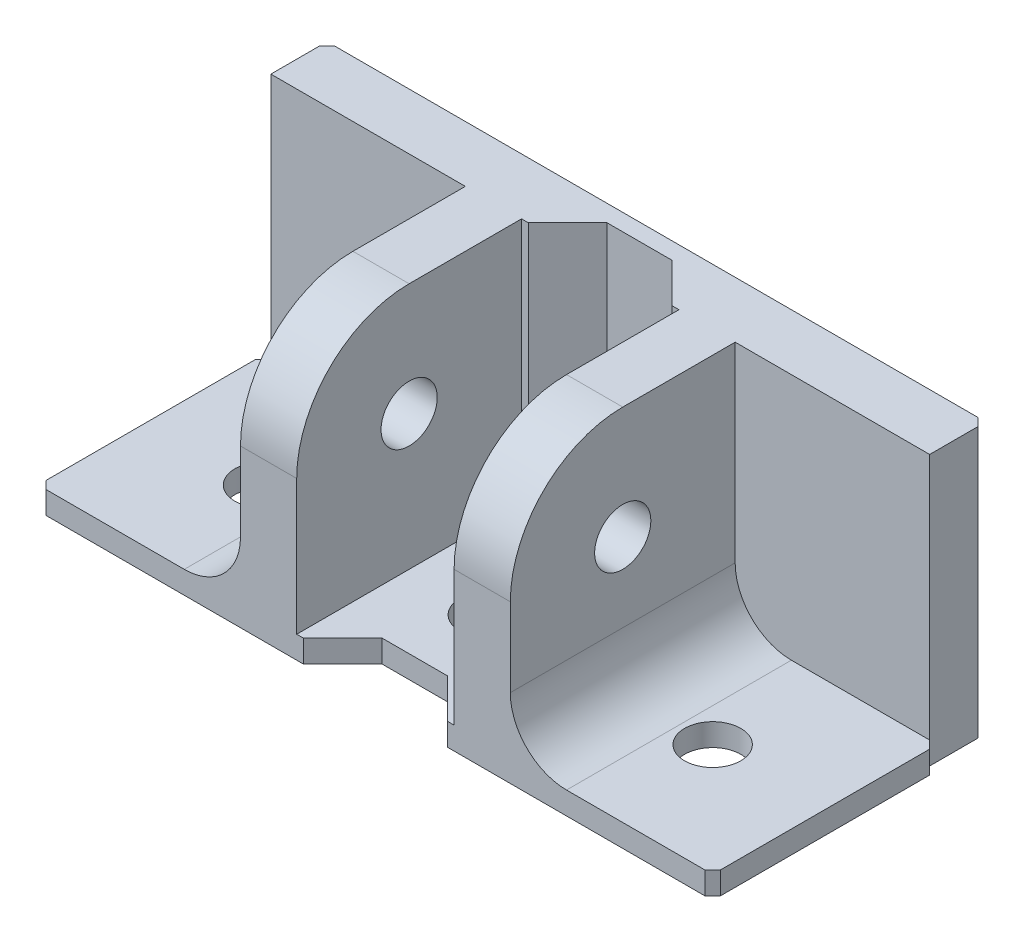
from build123d import *

# Parameters (mm, degrees)
SKETCH1_W           = 60
SKETCH1_H           = 20
SKETCH1_R           = 2.5
BOSS_EXTRUDE1_DEPTH = 2
FILLET1_SIZE        = 0.7
CUT_EXTRUDE2_DEPTH  = 2
BOSS_EXTRUDE3_DEPTH = 22
BOSS_EXTRUDE4_DEPTH = 24
CUT_EXTRUDE3_DEPTH  = 24
SKETCH6_R           = 2.5
CUT_EXTRUDE4_DEPTH  = 55.45181356
FILLET2_R           = 10
FILLET4_R           = 5
CHAMFER1_SIZE       = 0.7


with BuildPart() as part:
    # Sketch1 → Boss-Extrude1 (new body)
    with BuildSketch(Plane(origin=(0, 0, 0), x_dir=(1, 0, 0), z_dir=(0, 1, 0))):
        with Locations((30, 10)):
            Rectangle(SKETCH1_W, SKETCH1_H)
        with Locations(Location((10, 10, 0), (0, 0, 270))):
            Circle(SKETCH1_R, mode=Mode.SUBTRACT)
        with Locations(Location((30, 10, 0), (0, 0, 270))):
            Circle(SKETCH1_R, mode=Mode.SUBTRACT)
        with Locations(Location((50, 10, 0), (0, 0, 270))):
            Circle(SKETCH1_R, mode=Mode.SUBTRACT)
    extrude(amount=BOSS_EXTRUDE1_DEPTH)

    # Fillet1
    fillet1_edges = [part.edges().sort_by_distance(p)[0] for p in [
        (0, 1, -20),
        (60, 1, -20),
        (60, 1, 0),
        (0, 1, 0),
    ]]
    chamfer(fillet1_edges, length=FILLET1_SIZE)

    # Sketch2 → Cut-Extrude2 (cut)
    with BuildSketch(Plane(origin=(0, 2, 0), x_dir=(1, 0, 0), z_dir=(0, 1, 0))):
        Polygon((30, 20), (30, 16.5), (32.9, 16.5), (36.4, 20), (32.9, 20), align=None)
        Polygon((27.1, 16.5), (30, 16.5), (30, 20), (27.1, 20), (23.6, 20), align=None)
        Polygon((30, 0), (30, 3.5), (27.1, 3.5), (23.6, 0), (27.1, 0), align=None)
        Polygon((32.9, 3.5), (30, 3.5), (30, 0), (32.9, 0), (36.4, 0), align=None)
    extrude(amount=-CUT_EXTRUDE2_DEPTH, mode=Mode.SUBTRACT)

    # Sketch3 → Boss-Extrude3 (add)
    with BuildSketch(Plane(origin=(0, 2, 0), x_dir=(1, 0, 0), z_dir=(0, 1, 0))):
        Polygon((23, 0), (23, 10), (23, 20), (18, 20), (18, 0), align=None)
        Polygon((37, 20), (37, 10), (37, 0), (42, 0), (42, 20), align=None)
    extrude(amount=BOSS_EXTRUDE3_DEPTH)

    # Sketch4 → Boss-Extrude4 (add)
    with BuildSketch(Plane(origin=(0, 0, 0), x_dir=(1, 0, 0), z_dir=(0, 1, 0))):
        Polygon((0.7, 20), (0.7, 25), (59.3, 25), (59.3, 20), (23.6, 20), align=None)
    extrude(amount=BOSS_EXTRUDE4_DEPTH)

    # Sketch5 → Cut-Extrude3 (cut)
    with BuildSketch(Plane(origin=(0, 24, 0), x_dir=(1, 0, 0), z_dir=(0, 1, 0))):
        Polygon((23.6, 20), (27.100178567, 23.500178567), (32.900178567, 23.500178567), (36.4, 20), align=None)
    extrude(amount=-CUT_EXTRUDE3_DEPTH, mode=Mode.SUBTRACT)

    # Sketch6 → Cut-Extrude4 (cut, through all)
    with BuildSketch(Plane(origin=(42, 0, 0), x_dir=(0, 0, -1), z_dir=(1, 0, 0))):
        with Locations((10, 14)):
            Circle(SKETCH6_R)
    extrude(amount=-CUT_EXTRUDE4_DEPTH, mode=Mode.SUBTRACT)

    # Fillet2
    fillet2_edges = [part.edges().sort_by_distance(p)[0] for p in [
        (20.5, 24, 0),
        (39.5, 24, 0),
    ]]
    fillet(fillet2_edges, radius=FILLET2_R)

    # Fillet4
    fillet4_edges = [part.edges().sort_by_distance(p)[0] for p in [
        (18, 2, -10),
        (42, 2, -10),
    ]]
    fillet(fillet4_edges, radius=FILLET4_R)

    # Chamfer1
    chamfer1_edges = [part.edges().sort_by_distance(p)[0] for p in [
        (59.3, 12, -25),
        (0.7, 12, -25),
    ]]
    chamfer(chamfer1_edges, length=CHAMFER1_SIZE)


solid = part.part
